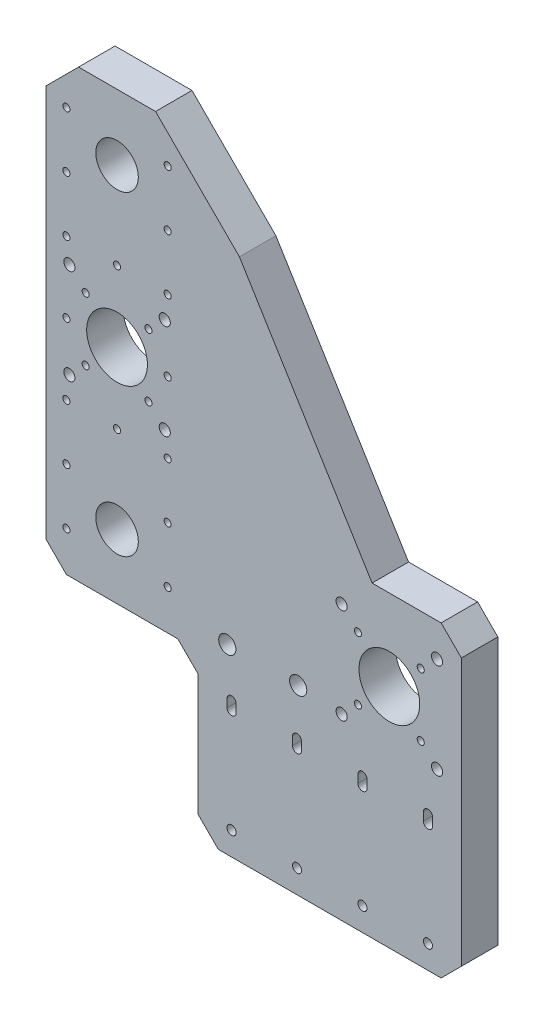
from build123d import *

# Parameters (mm, degrees)
MODEL_R             = 1.75
MODEL_R_2           = 2.25
MODEL_R_3           = 15
MODEL_R_4           = 2.75
MODEL_R_5           = 10.5
MODEL_R_6           = 4.25
BOSS_EXTRUDE1_DEPTH = 18


with BuildPart() as part:
    # Model → Boss-Extrude1 (new body)
    with BuildSketch(Plane.XY):
        Polygon((195, 0), (205, 10), (205, 141.83), (195, 151.83), (160.9225, 151.83), (95.411764706, 258.588235294), (54, 300), (16, 300), (0, 284), (0, 90), (10, 80), (65, 80), (75, 70), (75, 10), (85, 0), align=None)
        with Locations((60, 279.7)):
            Circle(MODEL_R, mode=Mode.SUBTRACT)
        with Locations((10, 279.7)):
            Circle(MODEL_R, mode=Mode.SUBTRACT)
        with Locations((10, 224.7)):
            Circle(MODEL_R, mode=Mode.SUBTRACT)
        with Locations((10, 154.7)):
            Circle(MODEL_R, mode=Mode.SUBTRACT)
        with Locations((10, 99.7)):
            Circle(MODEL_R, mode=Mode.SUBTRACT)
        with Locations((60, 99.7)):
            Circle(MODEL_R, mode=Mode.SUBTRACT)
        with Locations((60, 154.7)):
            Circle(MODEL_R, mode=Mode.SUBTRACT)
        with Locations((60, 224.7)):
            Circle(MODEL_R, mode=Mode.SUBTRACT)
        with Locations((10, 252.2)):
            Circle(MODEL_R, mode=Mode.SUBTRACT)
        with Locations((60, 252.2)):
            Circle(MODEL_R, mode=Mode.SUBTRACT)
        with Locations((35, 224.7)):
            Circle(MODEL_R, mode=Mode.SUBTRACT)
        with Locations((10, 189.7)):
            Circle(MODEL_R, mode=Mode.SUBTRACT)
        with Locations((60, 189.7)):
            Circle(MODEL_R, mode=Mode.SUBTRACT)
        with Locations((10, 127.2)):
            Circle(MODEL_R, mode=Mode.SUBTRACT)
        with Locations((60, 127.2)):
            Circle(MODEL_R, mode=Mode.SUBTRACT)
        with Locations((35, 154.7)):
            Circle(MODEL_R, mode=Mode.SUBTRACT)
        with Locations((91.54, 11.5)):
            Circle(MODEL_R_2, mode=Mode.SUBTRACT)
        with Locations((123.86, 11.5)):
            Circle(MODEL_R_2, mode=Mode.SUBTRACT)
        with Locations((156.18, 11.5)):
            Circle(MODEL_R_2, mode=Mode.SUBTRACT)
        with Locations((188.5, 11.5)):
            Circle(MODEL_R_2, mode=Mode.SUBTRACT)
        with Locations((50.5, 205.2)):
            Circle(MODEL_R, mode=Mode.SUBTRACT)
        with Locations((50.5, 174.2)):
            Circle(MODEL_R, mode=Mode.SUBTRACT)
        with Locations((35, 189.7)):
            Circle(MODEL_R_3, mode=Mode.SUBTRACT)
        with Locations((19.5, 174.2)):
            Circle(MODEL_R, mode=Mode.SUBTRACT)
        with Locations((19.5, 205.2)):
            Circle(MODEL_R, mode=Mode.SUBTRACT)
        with Locations((11.45, 213.25)):
            Circle(MODEL_R_4, mode=Mode.SUBTRACT)
        with Locations((58.55, 213.25)):
            Circle(MODEL_R_4, mode=Mode.SUBTRACT)
        with Locations((58.55, 166.15)):
            Circle(MODEL_R_4, mode=Mode.SUBTRACT)
        with Locations((11.45, 166.15)):
            Circle(MODEL_R_4, mode=Mode.SUBTRACT)
        with Locations((35, 111.81)):
            Circle(MODEL_R_5, mode=Mode.SUBTRACT)
        with Locations((35, 267.61)):
            Circle(MODEL_R_5, mode=Mode.SUBTRACT)
        with Locations((89.43, 89.83)):
            Circle(MODEL_R_6, mode=Mode.SUBTRACT)
        with Locations((124.43, 89.83)):
            Circle(MODEL_R_6, mode=Mode.SUBTRACT)
        with Locations((145.88, 135.38)):
            Circle(MODEL_R_4, mode=Mode.SUBTRACT)
        with Locations((192.98, 135.38)):
            Circle(MODEL_R_4, mode=Mode.SUBTRACT)
        with Locations((192.98, 88.28)):
            Circle(MODEL_R_4, mode=Mode.SUBTRACT)
        with Locations((145.88, 88.28)):
            Circle(MODEL_R_4, mode=Mode.SUBTRACT)
        with Locations((169.43, 111.83)):
            Circle(MODEL_R_3, mode=Mode.SUBTRACT)
        with Locations((153.93, 96.33)):
            Circle(MODEL_R, mode=Mode.SUBTRACT)
        with Locations((184.93, 127.33)):
            Circle(MODEL_R, mode=Mode.SUBTRACT)
        with Locations((184.93, 96.33)):
            Circle(MODEL_R, mode=Mode.SUBTRACT)
        with Locations((153.93, 127.33)):
            Circle(MODEL_R, mode=Mode.SUBTRACT)
        with BuildLine():
            Line((89.29, 66.7), (89.29, 62.7))
            ThreePointArc((89.29, 62.7), (91.54, 60.45), (93.79, 62.7))
            Line((93.79, 62.7), (93.79, 66.7))
            ThreePointArc((93.79, 66.7), (91.54, 68.95), (89.29, 66.7))
        make_face(mode=Mode.SUBTRACT)
        with BuildLine():
            Line((121.61, 66.7), (121.61, 62.7))
            ThreePointArc((121.61, 62.7), (123.86, 60.45), (126.11, 62.7))
            Line((126.11, 62.7), (126.11, 66.7))
            ThreePointArc((126.11, 66.7), (123.86, 68.95), (121.61, 66.7))
        make_face(mode=Mode.SUBTRACT)
        with BuildLine():
            Line((153.93, 66.7), (153.93, 62.7))
            ThreePointArc((153.93, 62.7), (156.18, 60.45), (158.43, 62.7))
            Line((158.43, 62.7), (158.43, 66.7))
            ThreePointArc((158.43, 66.7), (156.18, 68.95), (153.93, 66.7))
        make_face(mode=Mode.SUBTRACT)
        with BuildLine():
            Line((186.25, 66.7), (186.25, 62.7))
            ThreePointArc((186.25, 62.7), (188.5, 60.45), (190.75, 62.7))
            Line((190.75, 62.7), (190.75, 66.7))
            ThreePointArc((190.75, 66.7), (188.5, 68.95), (186.25, 66.7))
        make_face(mode=Mode.SUBTRACT)
    extrude(amount=BOSS_EXTRUDE1_DEPTH)


solid = part.part
